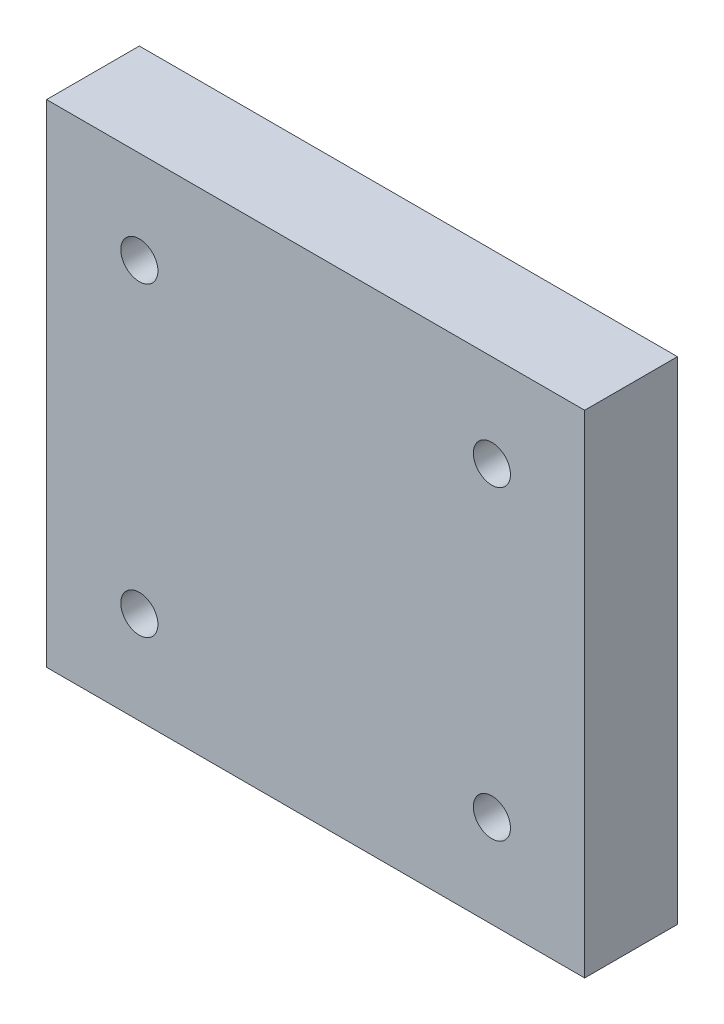
from build123d import *

# Parameters (mm, degrees)
SKETCH1_W           = 66
SKETCH1_H           = 50
SKETCH1_R           = 1
BOSS_EXTRUDE1_DEPTH = 5
SKETCH2_R           = 1
CUT_EXTRUDE1_DEPTH  = 388.996134001
SKETCH3_R           = 1
SKETCH3_W           = 20
SKETCH3_H           = 5
CUT_EXTRUDE2_DEPTH  = 388.996134001
CUT_EXTRUDE3_DEPTH  = 388.996134001
SKETCH5_OUTSIDE_W   = 171.322
SKETCH5_OUTSIDE_H   = 295.322
SKETCH5_OUTSIDE_W_2 = 29
SKETCH5_OUTSIDE_H_2 = 26.5
CUT_EXTRUDE4_DEPTH  = 388.996134001


with BuildPart() as part:
    # Sketch1 → Boss-Extrude1 (new body)
    # profile 1 of 3: a face of its own
    with BuildSketch(Plane.XY):
        with Locations((-33, 85)):
            Rectangle(SKETCH1_W, SKETCH1_H)
    # profile 2 of 3: a face of its own
    with BuildSketch(Plane.XY):
        Polygon((0, 60), (0, 0), (180, 0), (180, 60), (180, 110), (180, 300), (130, 300), (130, 150), (50, 150), (50, 300), (0, 300), (0, 110), align=None)
        with Locations((19, 117.5)):
            Circle(SKETCH1_R, mode=Mode.SUBTRACT)
        with Locations((38, 117.5)):
            Circle(SKETCH1_R, mode=Mode.SUBTRACT)
        with Locations((19, 134)):
            Circle(SKETCH1_R, mode=Mode.SUBTRACT)
        with Locations((38, 134)):
            Circle(SKETCH1_R, mode=Mode.SUBTRACT)
        with Locations((142, 117.5)):
            Circle(SKETCH1_R, mode=Mode.SUBTRACT)
        with Locations((161, 117.5)):
            Circle(SKETCH1_R, mode=Mode.SUBTRACT)
        with Locations((142, 134)):
            Circle(SKETCH1_R, mode=Mode.SUBTRACT)
        with Locations((161, 134)):
            Circle(SKETCH1_R, mode=Mode.SUBTRACT)
    # profile 3 of 3: a face of its own
    with BuildSketch(Plane.XY):
        with Locations((213, 85)):
            Rectangle(SKETCH1_W, SKETCH1_H)
    extrude(amount=BOSS_EXTRUDE1_DEPTH)

    # Sketch2 → Cut-Extrude1 (cut, through all)
    with BuildSketch(Plane.XY.offset(5)):
        with Locations((-58, 103)):
            Circle(SKETCH2_R)
        with Locations((-58, 67)):
            Circle(SKETCH2_R)
        with Locations(Location((238, 67, 0), (0, 0, 180))):
            Circle(SKETCH2_R)
        with Locations(Location((238, 103, 0), (0, 0, 180))):
            Circle(SKETCH2_R)
    extrude(amount=-CUT_EXTRUDE1_DEPTH, mode=Mode.SUBTRACT)

    # Sketch3 → Cut-Extrude2 (cut, through all)
    with BuildSketch(Plane.XY.offset(5)):
        with Locations((19, 77)):
            Circle(SKETCH3_R)
        with Locations((19, 99.5)):
            Circle(SKETCH3_R)
        with Locations(Location((161, 77, 0), (0, 0, 180))):
            Circle(SKETCH3_R)
        with Locations(Location((161, 99.5, 0), (0, 0, 180))):
            Circle(SKETCH3_R)
        with Locations((-6, 90)):
            Rectangle(SKETCH3_W, SKETCH3_H)
        with Locations((186, 90)):
            Rectangle(SKETCH3_W, SKETCH3_H)
    extrude(amount=-CUT_EXTRUDE2_DEPTH, mode=Mode.SUBTRACT)

    # Sketch4 → Cut-Extrude3 (cut, through all)
    with BuildSketch(Plane.XY.offset(5)):
        Polygon((180, 60), (130, 60), (130, 150), (65.062754068, 311.897276324), (-51.051297303, 321.248743549), (-107.939389585, -9.16976505), (175.332138424, -20.859099081), (198.321162017, 8.753880463), align=None)
    extrude(amount=-CUT_EXTRUDE3_DEPTH, mode=Mode.SUBTRACT)

    # Sketch5 outside → Cut-Extrude4 (cut, through all)
    with BuildSketch(Plane(origin=(0, 0, 0), x_dir=(-1, 0, 0), z_dir=(0, 0, -1))):
        with Locations((-188, 180)):
            Rectangle(SKETCH5_OUTSIDE_W, SKETCH5_OUTSIDE_H)
        with Locations((-151.5, 125.75)):
            Rectangle(SKETCH5_OUTSIDE_W_2, SKETCH5_OUTSIDE_H_2, mode=Mode.SUBTRACT)
    extrude(amount=-CUT_EXTRUDE4_DEPTH, mode=Mode.SUBTRACT)


solid = part.part
